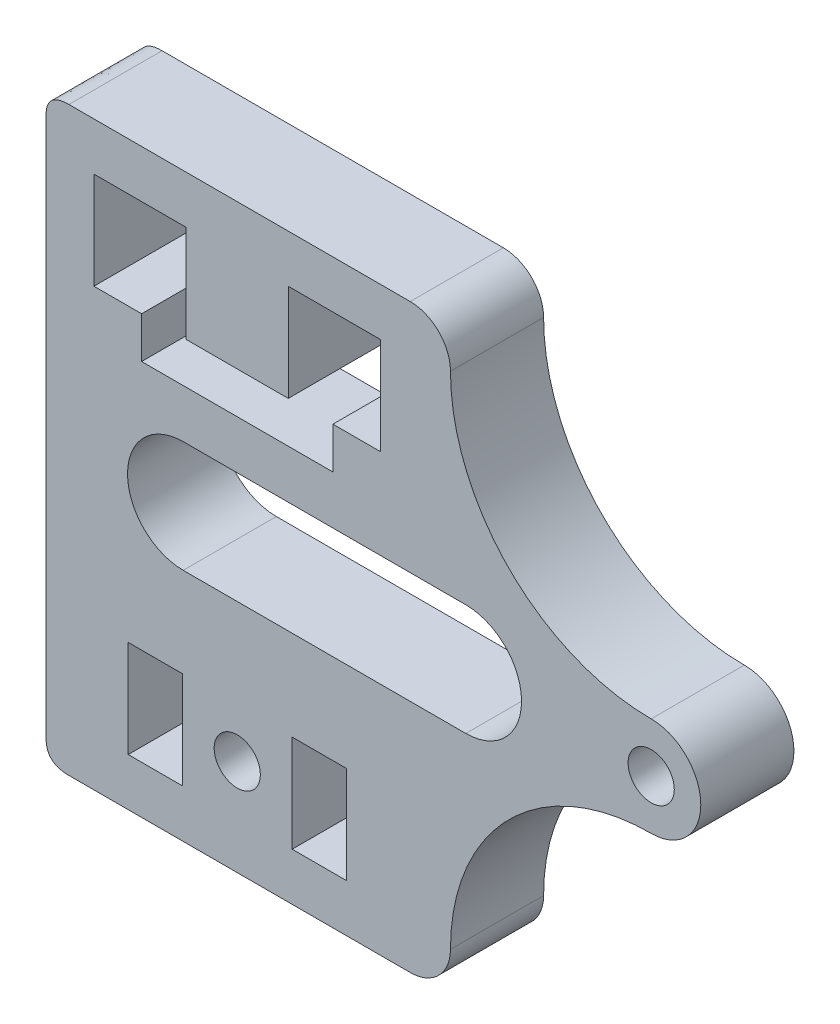
from build123d import *

# Parameters (mm, degrees)
SKETCH1_R           = 1.45
SKETCH1_W           = 3.400011
SKETCH1_H           = 6.1
BOSS_EXTRUDE2_DEPTH = 5.85
SKETCH2_R           = 1.25
CUT_EXTRUDE1_DEPTH  = 1


with BuildPart() as part:
    # Sketch1 → Boss-Extrude2 (new body)
    with BuildSketch(Plane.XY):
        with BuildLine():
            Line((388.984643017, 562.888903138), (410.424633118, 562.888903138))
            ThreePointArc((410.424633118, 562.888903138), (412.211329852, 562.148829119), (412.95140387, 560.362132386))
            ThreePointArc((412.95140387, 560.362132386), (416.644097047, 551.447182437), (425.559046996, 547.75448926))
            ThreePointArc((425.559046996, 547.75448926), (428.674633119, 544.638903138), (425.559046996, 541.523317015))
            ThreePointArc((425.559046996, 541.523317015), (416.644097047, 537.830623838), (412.95140387, 528.915673889))
            ThreePointArc((412.95140387, 528.915673889), (412.211329852, 527.128977156), (410.424633118, 526.388903138))
            Line((410.424633118, 526.388903138), (388.984643017, 526.388903138))
            add(Edge.make_bspline(
                [(387.555122745, 527.816961526), (387.476445389, 526.388903138), (388.984643017, 526.388903138)],
                knots=[0, 0, 0, 1, 1, 1], degree=2))
            Line((387.555122745, 527.816961526), (387.555122745, 561.460844041))
            add(Edge.make_bspline(
                [(387.555122745, 561.460844041), (387.476444597, 562.888903138), (388.984643017, 562.888903138)],
                knots=[0, 0, 0, 1, 1, 1], degree=2))
        make_face()
        with Locations((425.559046996, 544.638903138)):
            Circle(SKETCH1_R, mode=Mode.SUBTRACT)
        with Locations((399.559046996, 532.438903138)):
            Circle(SKETCH1_R, mode=Mode.SUBTRACT)
        Polygon((405.566920996, 551.188903138), (405.566920996, 553.788903138), (408.562971247, 553.788903138), (408.562971247, 559.888903138), (402.762971247, 559.888903138), (402.762971247, 553.788903138), (396.355122745, 553.788903138), (396.355122745, 559.888903138), (390.555122745, 559.888903138), (390.555122745, 553.788903138), (393.551172996, 553.788903138), (393.551172996, 551.188903138), align=None, mode=Mode.SUBTRACT)
        with Locations((394.409041496, 532.438903138)):
            Rectangle(SKETCH1_W, SKETCH1_H, mode=Mode.SUBTRACT)
        with Locations((404.709052496, 532.438903138)):
            Rectangle(SKETCH1_W, SKETCH1_H, mode=Mode.SUBTRACT)
        with BuildLine():
            Line((396.165690223, 548.138903138), (413.915690223, 548.138903138))
            ThreePointArc((413.915690223, 548.138903138), (417.415690223, 544.638903138), (413.915690223, 541.138903138))
            Line((413.915690223, 541.138903138), (396.165690223, 541.138903138))
            ThreePointArc((396.165690223, 541.138903138), (392.665690223, 544.638903138), (396.165690223, 548.138903138))
        make_face(mode=Mode.SUBTRACT)
    extrude(amount=BOSS_EXTRUDE2_DEPTH)

    # Sketch2 → Cut-Extrude1 (cut)
    with BuildSketch(Plane.XY):
        with Locations((409.659057996, 532.438903138)):
            Circle(SKETCH2_R)
    extrude(amount=CUT_EXTRUDE1_DEPTH, mode=Mode.SUBTRACT)


solid = part.part
